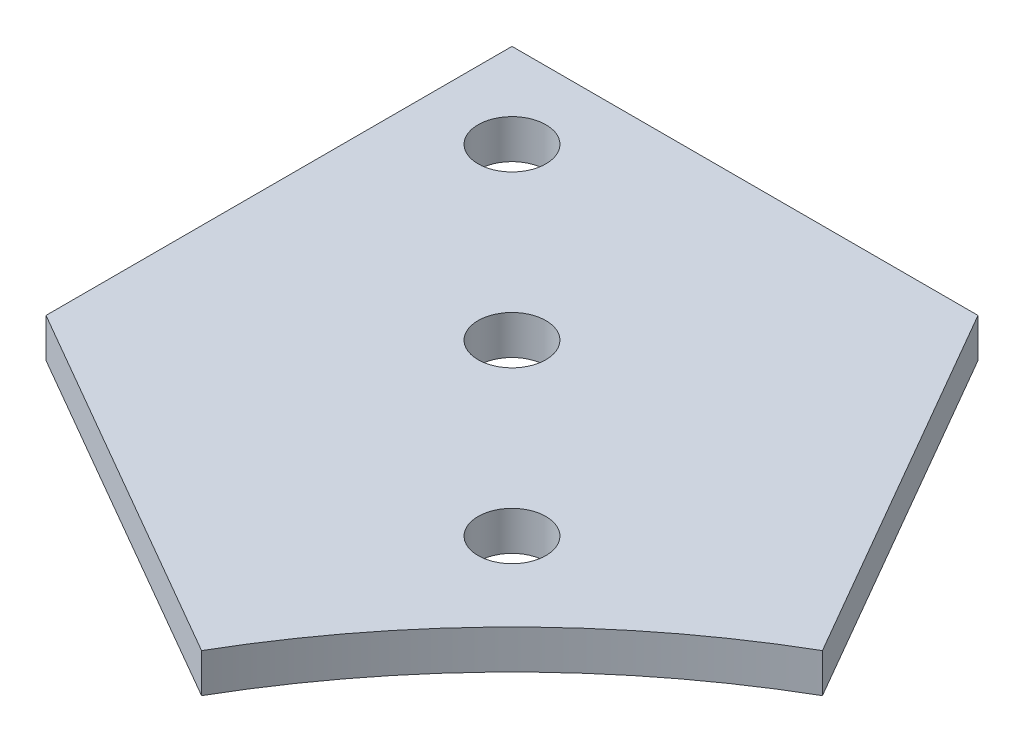
from build123d import *

# Parameters (mm, degrees)
BOSS_EXTRUDE1_DEPTH = 2.3
SKETCH4_R           = 2
SKETCH4_R_2         = 50
CUT_EXTRUDE1_DEPTH  = 92.952650859


with BuildPart() as part:
    # Sketch3 → Boss-Extrude1 (new body)
    with BuildSketch(Plane(origin=(0, 0, 0), x_dir=(1, 0, 0), z_dir=(0, 1, 0))):
        Polygon((-65, 65), (-37.527767497, 65), (-25, 43.301270189), (-43.301270189, 25), (-65, 37.527767497), align=None)
    extrude(amount=BOSS_EXTRUDE1_DEPTH)

    # Sketch4 → Cut-Extrude1 (cut, through all)
    with BuildSketch(Plane(origin=(0, 2.3, 0), x_dir=(1, 0, 0), z_dir=(0, 1, 0))):
        with Locations(Location((-60, 60, 0), (0, 0, 270))):
            Circle(SKETCH4_R)
        with Locations(Location((-50, 50, 0), (0, 0, 270))):
            Circle(SKETCH4_R)
        with Locations(Location((-40, 40, 0), (0, 0, 270))):
            Circle(SKETCH4_R)
        Circle(SKETCH4_R_2)
    extrude(amount=-CUT_EXTRUDE1_DEPTH, mode=Mode.SUBTRACT)


solid = part.part
